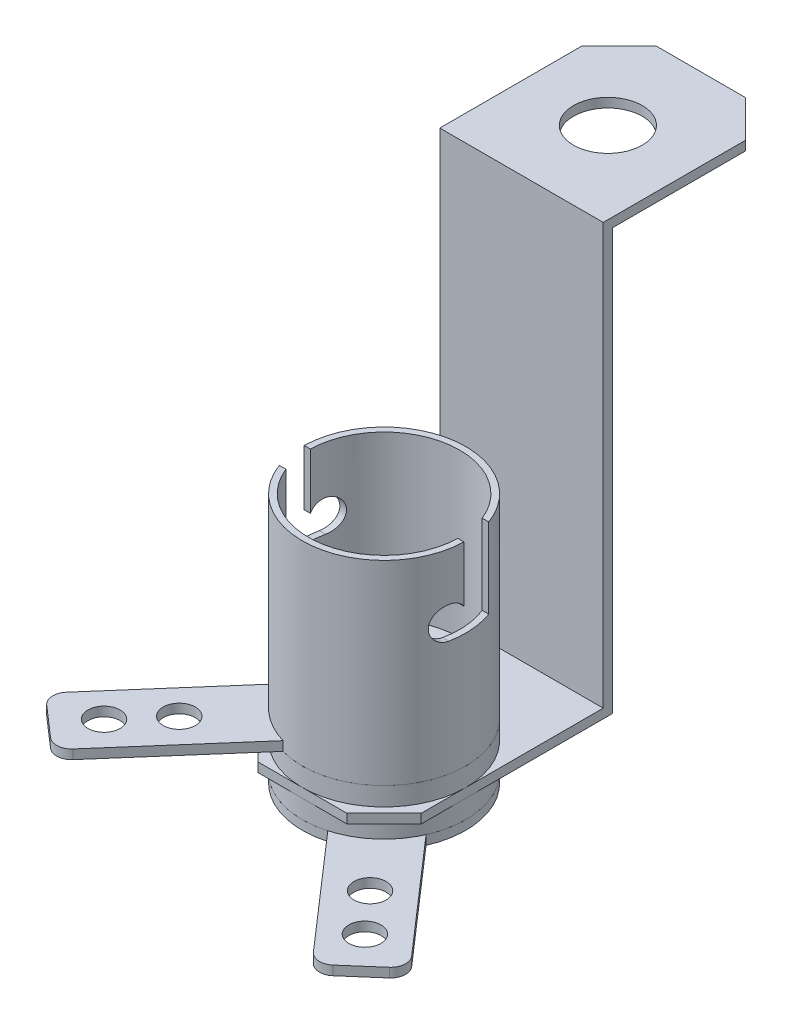
from build123d import *

# Parameters (mm, degrees)
SKETCH1_R           = 2.3495
BOSS_EXTRUDE1_DEPTH = 0.635
SKETCH2_W           = 11.176
SKETCH2_H           = 0.635
BOSS_EXTRUDE2_DEPTH = 28.7655
SKETCH3_W           = 11.176
SKETCH3_H           = 0.635
BOSS_EXTRUDE3_DEPTH = 14.986
CUT_EXTRUDE1_DEPTH  = 41.009737021
SKETCH5_R           = 5.588
BOSS_EXTRUDE4_DEPTH = 1.27
SKETCH6_R           = 1.09855
BOSS_EXTRUDE5_DEPTH = 0.635
SKETCH7_R           = 5.588
BOSS_EXTRUDE6_DEPTH = 1.27
SKETCH8_R           = 1.09855
BOSS_EXTRUDE7_DEPTH = 0.635
SKETCH9_R           = 5.588
SKETCH9_R_2         = 5.1689
BOSS_EXTRUDE8_DEPTH = 12.7
SKETCH10_R          = 5.1689
BOSS_EXTRUDE9_DEPTH = 1.6002
CUT_EXTRUDE2_DEPTH  = 49.520560567
CIRPATTERN1_COUNT   = 2


with BuildPart() as part:
    # Sketch1 → Boss-Extrude1 (new body)
    with BuildSketch(Plane(origin=(0, 0, 0), x_dir=(1, 0, 0), z_dir=(0, 1, 0))):
        Polygon((-3.048, 0), (3.048, 0), (5.588, -2.54), (5.588, -12.2555), (-5.588, -12.2555), (-5.588, -2.54), align=None)
        with Locations(Location((0, -6.35, 0), (0, 0, 270))):
            Circle(SKETCH1_R, mode=Mode.SUBTRACT)
    extrude(amount=-BOSS_EXTRUDE1_DEPTH)

    # Sketch2 → Boss-Extrude2 (add)
    with BuildSketch(Plane.XZ.offset(0.635)):
        with Locations((0, 11.938)):
            Rectangle(SKETCH2_W, SKETCH2_H)
    extrude(amount=BOSS_EXTRUDE2_DEPTH)

    # Sketch3 → Boss-Extrude3 (add)
    with BuildSketch(Plane.XY.offset(12.2555)):
        with Locations((0, -29.083)):
            Rectangle(SKETCH3_W, SKETCH3_H)
    extrude(amount=BOSS_EXTRUDE3_DEPTH)

    # Sketch4 → Cut-Extrude1 (cut, through all)
    with BuildSketch(Plane(origin=(0, -28.7655, 0), x_dir=(1, 0, 0), z_dir=(0, 1, 0))):
        Polygon((-5.588, -24.7015), (-3.048, -27.2415), (-5.588, -27.2415), align=None)
        Polygon((5.588, -27.2415), (5.588, -24.7015), (3.048, -27.2415), align=None)
    extrude(amount=-CUT_EXTRUDE1_DEPTH, mode=Mode.SUBTRACT)


with BuildPart() as body_2:
    # Sketch5 → Boss-Extrude4 (new body)
    with BuildSketch(Plane(origin=(0, -28.7655, 0), x_dir=(1, 0, 0), z_dir=(0, 1, 0))):
        with Locations(Location((0, -21.6535, 0), (0, 0, 270))):
            Circle(SKETCH5_R)
    extrude(amount=BOSS_EXTRUDE4_DEPTH)


with BuildPart() as body_3:
    # Sketch6 → Boss-Extrude5 (new body)
    with BuildSketch(Plane(origin=(0, -27.4955, 0), x_dir=(1, 0, 0), z_dir=(0, 1, 0))):
        with BuildLine():
            Line((-11.810256461, -31.57548538), (-5.117028214, -23.898887775))
            ThreePointArc((-5.117028214, -23.898887775), (3.672323944, -17.441638078), (-1.527373166, -27.028709318))
            Line((-1.527373166, -27.028709318), (-8.220601414, -34.705306923))
            ThreePointArc((-8.220601414, -34.705306923), (-8.917028861, -35.051240986), (-9.654089753, -34.803404738))
            Line((-9.654089753, -34.803404738), (-11.712158647, -33.00897372))
            ThreePointArc((-11.712158647, -33.00897372), (-12.05809271, -32.312546272), (-11.810256461, -31.57548538))
        make_face()
        with Locations(Location((-8.91790485, -31.881623782, 0), (0, 0, 270))):
            Circle(SKETCH6_R, mode=Mode.SUBTRACT)
        with Locations(Location((-6.522548095, -29.134341119, 0), (0, 0, 270))):
            Circle(SKETCH6_R, mode=Mode.SUBTRACT)
    extrude(amount=BOSS_EXTRUDE5_DEPTH)

    # Sketch9 → Boss-Extrude8 (add)
    with BuildSketch(Plane(origin=(0, -26.8605, 0), x_dir=(-1, 0, 0), z_dir=(0, -1, 0))):
        with Locations(Location((0, -21.6535, 0), (0, 0, 270))):
            Circle(SKETCH9_R)
        with Locations(Location((0, -21.6535, 0), (0, 0, 90))):
            Circle(SKETCH9_R_2, mode=Mode.SUBTRACT)
    extrude(amount=-BOSS_EXTRUDE8_DEPTH)

    # Sketch10 → Boss-Extrude9 (add)
    with BuildSketch(Plane(origin=(0, -26.8605, 0), x_dir=(-1, 0, 0), z_dir=(0, -1, 0))):
        with Locations(Location((0, -21.6535, 0), (0, 0, 90))):
            Circle(SKETCH10_R)
    extrude(amount=-BOSS_EXTRUDE9_DEPTH)

    # Sketch11 → Cut-Extrude2 (cut, through all)
    with BuildSketch(Plane(origin=(0, 0, 0), x_dir=(0, 0, -1), z_dir=(1, 0, 0))):
        with BuildLine():
            Line((-19.7485, -14.1605), (-19.7485, -19.6215))
            Line((-19.7485, -19.6215), (-22.707686982, -19.6215))
            ThreePointArc((-22.707686982, -19.6215), (-23.654454734, -18.003953613), (-21.7805, -17.9705))
            Line((-21.7805, -17.9705), (-21.7805, -14.1605))
            Line((-21.7805, -14.1605), (-19.7485, -14.1605))
        make_face()
    cut_extrude2 = extrude(amount=CUT_EXTRUDE2_DEPTH, mode=Mode.SUBTRACT)

    # CirPattern1: Cut-Extrude2 ×2 about axis
    cirpattern1_axis = Axis((0, -14.1605, 21.6535), (0, -1, 0))
    for i in range(1, CIRPATTERN1_COUNT):
        add(cut_extrude2.rotate(cirpattern1_axis, i * 360 / CIRPATTERN1_COUNT), mode=Mode.SUBTRACT)


with BuildPart() as body_4:
    # Sketch7 → Boss-Extrude6 (new body)
    with BuildSketch(Plane(origin=(0, -29.4005, 0), x_dir=(1, 0, 0), z_dir=(0, 1, 0))):
        with Locations(Location((0, -21.6535, 0), (0, 0, 270))):
            Circle(SKETCH7_R)
    extrude(amount=-BOSS_EXTRUDE6_DEPTH)


with BuildPart() as body_5:
    # Sketch8 → Boss-Extrude7 (new body)
    with BuildSketch(Plane(origin=(0, -30.6705, 0), x_dir=(1, 0, 0), z_dir=(0, 1, 0))):
        with BuildLine():
            Line((11.712158647, -33.00897372), (9.654089753, -34.803404738))
            ThreePointArc((9.654089753, -34.803404738), (8.917028861, -35.051240986), (8.220601414, -34.705306923))
            Line((8.220601414, -34.705306923), (1.527373166, -27.028709318))
            ThreePointArc((1.527373166, -27.028709318), (-3.672323944, -17.441638078), (5.117028214, -23.898887775))
            Line((5.117028214, -23.898887775), (11.810256461, -31.57548538))
            ThreePointArc((11.810256461, -31.57548538), (12.05809271, -32.312546272), (11.712158647, -33.00897372))
        make_face()
        with Locations(Location((6.522548095, -29.134341119, 0), (0, 0, 270))):
            Circle(SKETCH8_R, mode=Mode.SUBTRACT)
        with Locations(Location((8.91790485, -31.881623782, 0), (0, 0, 270))):
            Circle(SKETCH8_R, mode=Mode.SUBTRACT)
    extrude(amount=-BOSS_EXTRUDE7_DEPTH)


solid = Compound([part.part, body_2.part, body_3.part, body_4.part, body_5.part])
